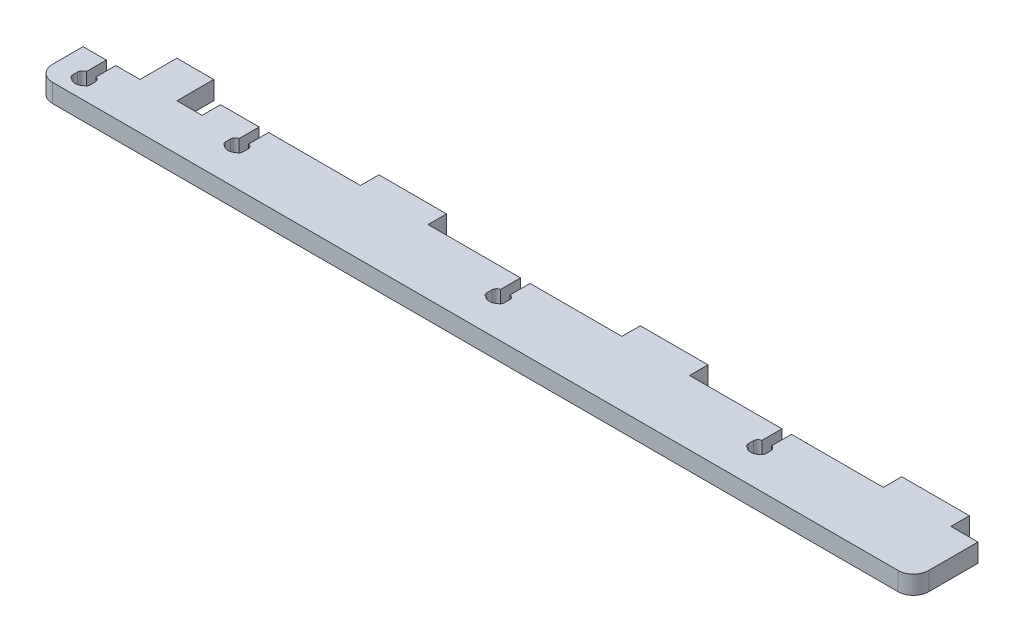
from build123d import *

# Parameters (mm, degrees)
SALIENTE_EXTRUIR1_DEPTH = 6


with BuildPart() as part:
    # Croquis1 → Saliente-Extruir1 (new body)
    with BuildSketch(Plane(origin=(0, 0, 0), x_dir=(1, 0, 0), z_dir=(0, 1, 0))):
        with BuildLine():
            Line((-114.926621199, -5.742358079), (-122.476621199, -5.742358079))
            Line((-122.476621199, -5.742358079), (-122.476621199, -15.742358079))
            ThreePointArc((-122.476621199, -15.742358079), (-121.012155104, -19.277891985), (-117.476621199, -20.742358079))
            Line((-117.476621199, -20.742358079), (157.523378801, -20.742358079))
            ThreePointArc((157.523378801, -20.742358079), (161.058912707, -19.277891985), (162.523378801, -15.742358079))
            Line((162.523378801, -15.742358079), (162.523378801, -0.742358079))
            Line((162.523378801, -0.742358079), (162.523378801, 0.257641921))
            Line((162.523378801, 0.257641921), (154.223378801, 0.257641921))
            Line((154.223378801, 0.257641921), (153.723378801, 0.257641921))
            Line((153.723378801, 0.257641921), (153.723378801, 6.257641921))
            Line((153.723378801, 6.257641921), (131.723378801, 6.257641921))
            Line((131.723378801, 6.257641921), (131.723378801, 0.257641921))
            Line((131.723378801, 0.257641921), (131.223378801, 0.257641921))
            Line((131.223378801, 0.257641921), (101.873378801, 0.257641921))
            Line((101.873378801, 0.257641921), (101.873378801, -6.242583321))
            ThreePointArc((101.873378801, -6.242583321), (102.797983436, -6.770672857), (103.163716432, -7.770678689))
            Line((103.163716432, -7.770678689), (103.163716432, -9.320678689))
            ThreePointArc((103.163716432, -9.320678689), (102.975019602, -10.061862661), (102.454872975, -10.622583321))
            Line((102.454872975, -10.622583321), (102.285628043, -10.622583321))
            ThreePointArc((102.285628043, -10.622583321), (100.323378801, -11.435593306), (98.36112956, -10.622583321))
            Line((98.36112956, -10.622583321), (98.191884628, -10.622583321))
            ThreePointArc((98.191884628, -10.622583321), (97.671738001, -10.061862661), (97.483041171, -9.320678689))
            Line((97.483041171, -9.320678689), (97.483041171, -7.770678689))
            ThreePointArc((97.483041171, -7.770678689), (97.848774167, -6.770672857), (98.773378801, -6.242583321))
            Line((98.773378801, -6.242583321), (98.773378801, 0.257641921))
            Line((98.773378801, 0.257641921), (69.223378801, 0.257641921))
            Line((69.223378801, 0.257641921), (68.723378801, 0.257641921))
            Line((68.723378801, 0.257641921), (68.723378801, 6.257641921))
            Line((68.723378801, 6.257641921), (46.723378801, 6.257641921))
            Line((46.723378801, 6.257641921), (46.723378801, 0.257641921))
            Line((46.723378801, 0.257641921), (46.223378801, 0.257641921))
            Line((46.223378801, 0.257641921), (16.873378801, 0.257641921))
            Line((16.873378801, 0.257641921), (16.873378801, -6.242583321))
            ThreePointArc((16.873378801, -6.242583321), (17.797983436, -6.770672857), (18.163716432, -7.770678689))
            Line((18.163716432, -7.770678689), (18.163716432, -9.320678689))
            ThreePointArc((18.163716432, -9.320678689), (17.975019602, -10.061862661), (17.454872975, -10.622583321))
            Line((17.454872975, -10.622583321), (17.285628043, -10.622583321))
            ThreePointArc((17.285628043, -10.622583321), (15.323378801, -11.435593306), (13.36112956, -10.622583321))
            Line((13.36112956, -10.622583321), (13.191884628, -10.622583321))
            ThreePointArc((13.191884628, -10.622583321), (12.671738001, -10.061862661), (12.483041171, -9.320678689))
            Line((12.483041171, -9.320678689), (12.483041171, -7.770678689))
            ThreePointArc((12.483041171, -7.770678689), (12.848774167, -6.770672857), (13.773378801, -6.242583321))
            Line((13.773378801, -6.242583321), (13.773378801, 0.257641921))
            Line((13.773378801, 0.257641921), (-14.776621199, 0.257641921))
            Line((-14.776621199, 0.257641921), (-15.776621199, 0.257641921))
            Line((-15.776621199, 0.257641921), (-16.276621199, 0.257641921))
            Line((-16.276621199, 0.257641921), (-16.276621199, 6.257641921))
            Line((-16.276621199, 6.257641921), (-38.276621199, 6.257641921))
            Line((-38.276621199, 6.257641921), (-38.276621199, 0.257641921))
            Line((-38.276621199, 0.257641921), (-38.776621199, 0.257641921))
            Line((-38.776621199, 0.257641921), (-39.776621199, 0.257641921))
            Line((-39.776621199, 0.257641921), (-68.126621199, 0.257641921))
            Line((-68.126621199, 0.257641921), (-68.126621199, -6.242583321))
            ThreePointArc((-68.126621199, -6.242583321), (-67.202016564, -6.770672857), (-66.836283568, -7.770678689))
            Line((-66.836283568, -7.770678689), (-66.836283568, -9.320678689))
            ThreePointArc((-66.836283568, -9.320678689), (-67.024980398, -10.061862661), (-67.545127025, -10.622583321))
            Line((-67.545127025, -10.622583321), (-67.714371957, -10.622583321))
            ThreePointArc((-67.714371957, -10.622583321), (-69.676621199, -11.435593306), (-71.63887044, -10.622583321))
            Line((-71.63887044, -10.622583321), (-71.808115372, -10.622583321))
            ThreePointArc((-71.808115372, -10.622583321), (-72.328261999, -10.061862661), (-72.516958829, -9.320678689))
            Line((-72.516958829, -9.320678689), (-72.516958829, -7.770678689))
            ThreePointArc((-72.516958829, -7.770678689), (-72.151225833, -6.770672857), (-71.226621199, -6.242583321))
            Line((-71.226621199, -6.242583321), (-71.226621199, 0.257641921))
            Line((-71.226621199, 0.257641921), (-83.776621199, 0.257641921))
            Line((-83.776621199, 0.257641921), (-83.776621199, -5.742358079))
            Line((-83.776621199, -5.742358079), (-90.476621199, -5.742358079))
            Line((-90.476621199, -5.742358079), (-91.476621199, -5.742358079))
            Line((-91.476621199, -5.742358079), (-91.976621199, -5.742358079))
            Line((-91.976621199, -5.742358079), (-91.976621199, 6.257641921))
            Line((-91.976621199, 6.257641921), (-103.976621199, 6.257641921))
            Line((-103.976621199, 6.257641921), (-103.976621199, -5.742358079))
            Line((-103.976621199, -5.742358079), (-104.476621199, -5.742358079))
            Line((-104.476621199, -5.742358079), (-105.476621199, -5.742358079))
            Line((-105.476621199, -5.742358079), (-111.826621199, -5.742358079))
            Line((-111.826621199, -5.742358079), (-111.826621199, -12.242583321))
            ThreePointArc((-111.826621199, -12.242583321), (-110.902016564, -12.770672857), (-110.536283568, -13.770678689))
            Line((-110.536283568, -13.770678689), (-110.536283568, -15.320678689))
            ThreePointArc((-110.536283568, -15.320678689), (-110.724980398, -16.061862661), (-111.245127025, -16.622583321))
            Line((-111.245127025, -16.622583321), (-111.414371957, -16.622583321))
            ThreePointArc((-111.414371957, -16.622583321), (-113.376621199, -17.435593306), (-115.33887044, -16.622583321))
            Line((-115.33887044, -16.622583321), (-115.508115372, -16.622583321))
            ThreePointArc((-115.508115372, -16.622583321), (-116.028261999, -16.061862661), (-116.216958829, -15.320678689))
            Line((-116.216958829, -15.320678689), (-116.216958829, -13.770678689))
            ThreePointArc((-116.216958829, -13.770678689), (-115.851225833, -12.770672857), (-114.926621199, -12.242583321))
            Line((-114.926621199, -12.242583321), (-114.926621199, -5.742358079))
        make_face()
    extrude(amount=SALIENTE_EXTRUIR1_DEPTH)


solid = part.part
